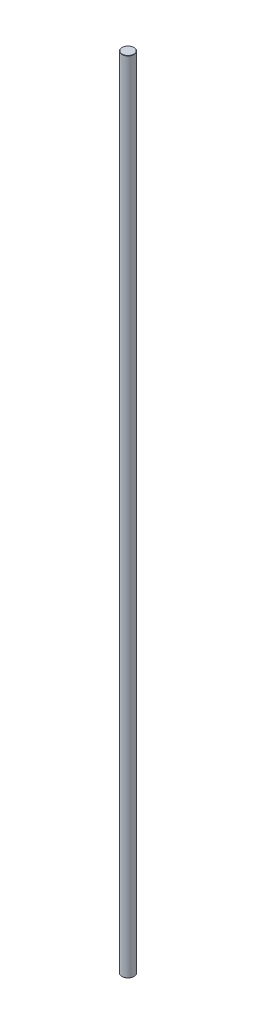
from build123d import *

# Parameters (mm, degrees)
SKETCH1_R           = 6.35
BOSS_EXTRUDE1_DEPTH = 419.1
CHAMFER1_SIZE       = 0.254


with BuildPart() as part:
    # Sketch1 → Boss-Extrude1 (new, symmetric)
    with BuildSketch(Plane(origin=(0, 0, 0), x_dir=(1, 0, 0), z_dir=(0, 1, 0))):
        with Locations(Location((0, 0, 0), (0, 0, 270))):
            Circle(SKETCH1_R)
    extrude(amount=BOSS_EXTRUDE1_DEPTH, both=True)

    # Chamfer1
    chamfer1_edges = [part.edges().sort_by_distance(p)[0] for p in [
        (0, -419.1, -6.35),
        (0, 419.1, -6.35),
    ]]
    chamfer(chamfer1_edges, length=CHAMFER1_SIZE)


solid = part.part
